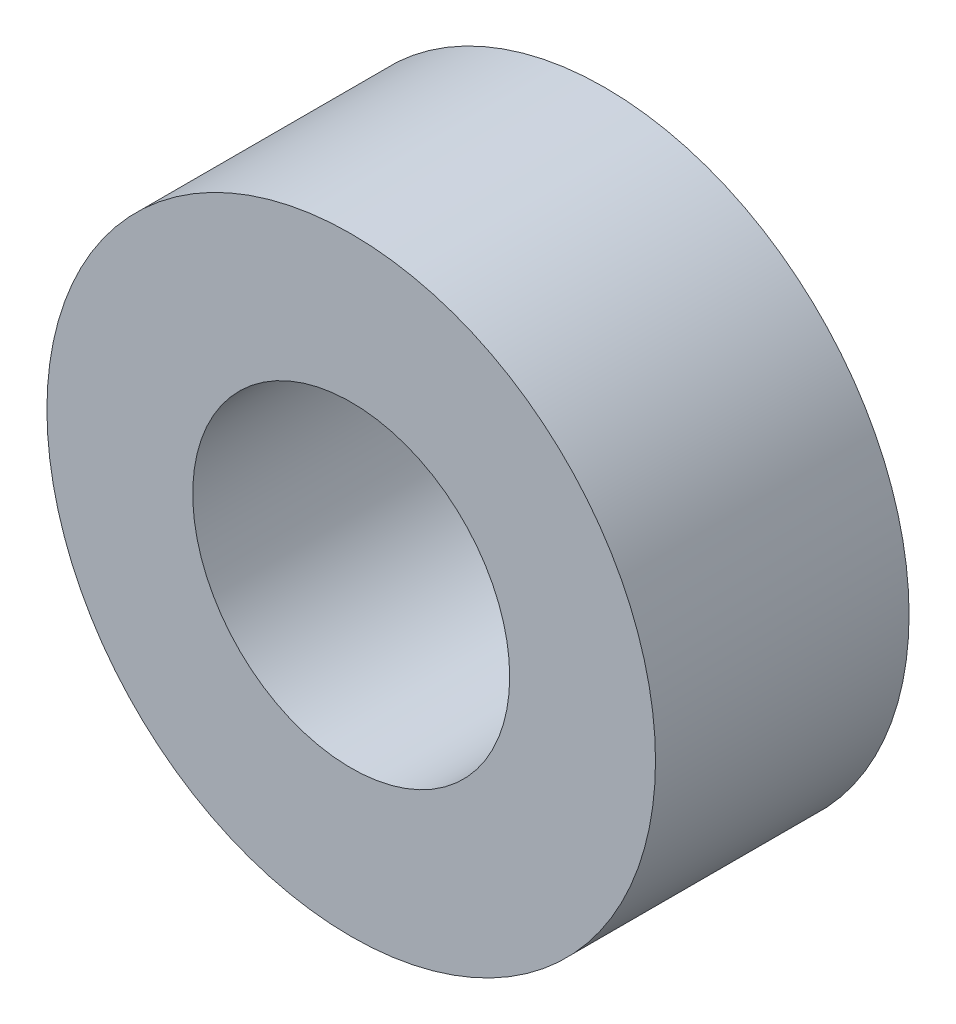
from build123d import *

# Parameters (mm, degrees)
SKETCH1_R           = 6
SKETCH1_R_2         = 3.125
BOSS_EXTRUDE1_DEPTH = 2.5


with BuildPart() as part:
    # Sketch1 → Boss-Extrude1 (new, symmetric)
    with BuildSketch(Plane.XY):
        Circle(SKETCH1_R)
        Circle(SKETCH1_R_2, mode=Mode.SUBTRACT)
    extrude(amount=BOSS_EXTRUDE1_DEPTH, both=True)


solid = part.part
